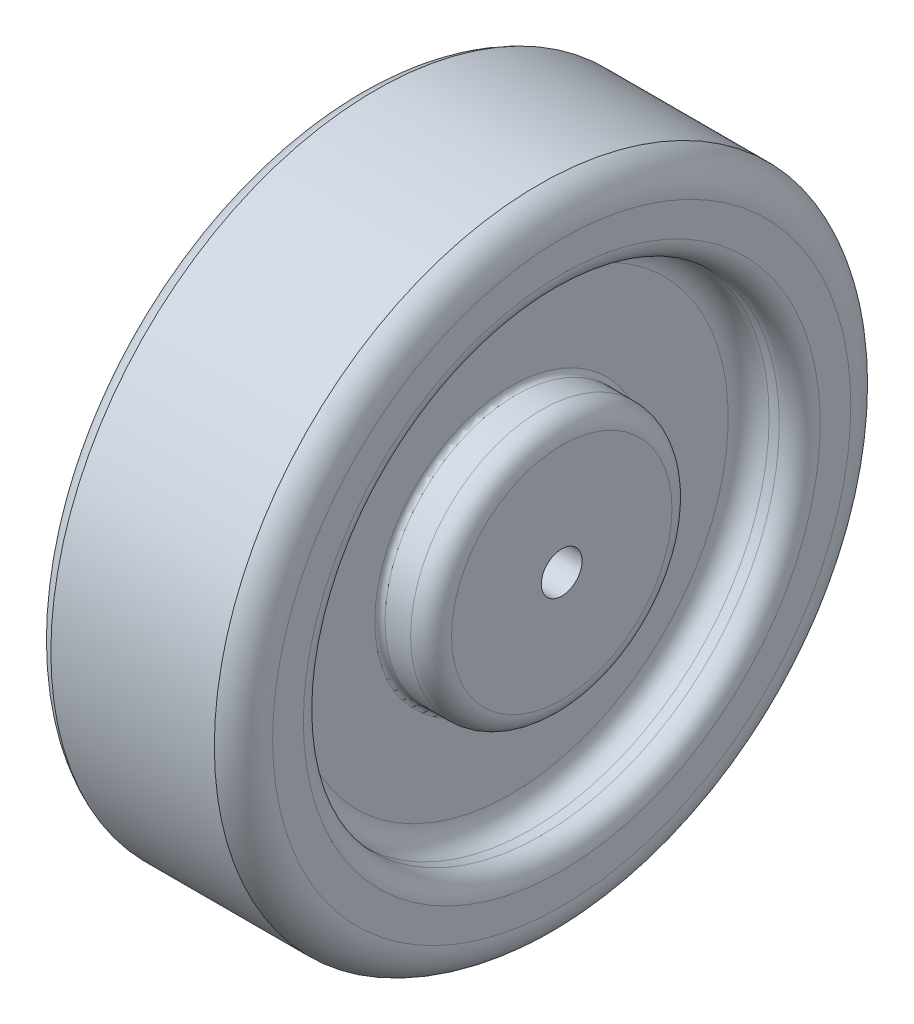
from build123d import *

# Parameters (mm, degrees)
SALIENTE_EXTRUIR1_START = -41
CROQUIS4_R              = 5.582222484
CROQUIS4_R_2            = 4
SALIENTE_EXTRUIR1_DEPTH = 41
CROQUIS5_W              = 12.255797116
CROQUIS5_H              = 0.592739778
CORTAR_EXTRUIR1_DEPTH   = 43.5


with BuildPart() as part:
    # Croquis3 → Revolución1 (revolve)
    with BuildSketch(Plane(origin=(0, 0, 0), x_dir=(1, 0, 0), z_dir=(0, 1, 0))):
        with BuildLine():
            Line((-20.5, -2), (20.5, -2))
            Line((20.5, -2), (20.5, -17))
            Line((20.5, -17), (20.5, -18))
            ThreePointArc((20.5, -18), (19.328427125, -20.828427125), (16.5, -22))
            Line((16.5, -22), (11.5, -22))
            ThreePointArc((11.5, -22), (10.792893219, -22.292893219), (10.5, -23))
            Line((10.5, -23), (10.5, -39))
            ThreePointArc((10.5, -39), (11.671572875, -41.828427125), (14.5, -43))
            Line((14.5, -43), (16.5, -43))
            ThreePointArc((16.5, -43), (19.328427125, -44.171572875), (20.5, -47))
            Line((20.5, -47), (20.5, -48))
            Line((20.5, -48), (20.5, -53))
            ThreePointArc((20.5, -53), (19.377853013, -57.192554816), (16, -59.917777516))
            Line((16, -59.917777516), (-16, -59.917777516))
            ThreePointArc((-16, -59.917777516), (-19.377853013, -57.192554816), (-20.5, -53))
            Line((-20.5, -53), (-20.5, -48))
            Line((-20.5, -48), (-20.5, -47))
            ThreePointArc((-20.5, -47), (-19.328427125, -44.171572875), (-16.5, -43))
            Line((-16.5, -43), (-14.5, -43))
            ThreePointArc((-14.5, -43), (-11.671572875, -41.828427125), (-10.5, -39))
            Line((-10.5, -39), (-10.5, -23))
            ThreePointArc((-10.5, -23), (-10.792893219, -22.292893219), (-11.5, -22))
            Line((-11.5, -22), (-16.5, -22))
            ThreePointArc((-16.5, -22), (-19.328427125, -20.828427125), (-20.5, -18))
            Line((-20.5, -18), (-20.5, -17))
            Line((-20.5, -17), (-20.5, -2))
        make_face()
    revolve(axis=Axis((-20.5, 0, -3.582222484), (1, 0, 0)))

    # Croquis4 → Saliente-Extruir1 (add)
    with BuildSketch(Plane.ZY.offset(20.5).offset(SALIENTE_EXTRUIR1_START)):
        with Locations((-3.582222484, 0)):
            Circle(CROQUIS4_R)
        with Locations((-3.582222484, 0)):
            Circle(CROQUIS4_R_2, mode=Mode.SUBTRACT)
    extrude(amount=SALIENTE_EXTRUIR1_DEPTH)

    # Croquis5 → Cortar-Extruir1 (cut, symmetric)
    with BuildSketch(Plane(origin=(0, 0, 0), x_dir=(0, 0, -1), z_dir=(1, 0, 0))):
        with Locations((3.582222484, -63.5)):
            Rectangle(CROQUIS5_W, CROQUIS5_H)
    extrude(amount=CORTAR_EXTRUIR1_DEPTH, both=True, mode=Mode.SUBTRACT)


solid = part.part
